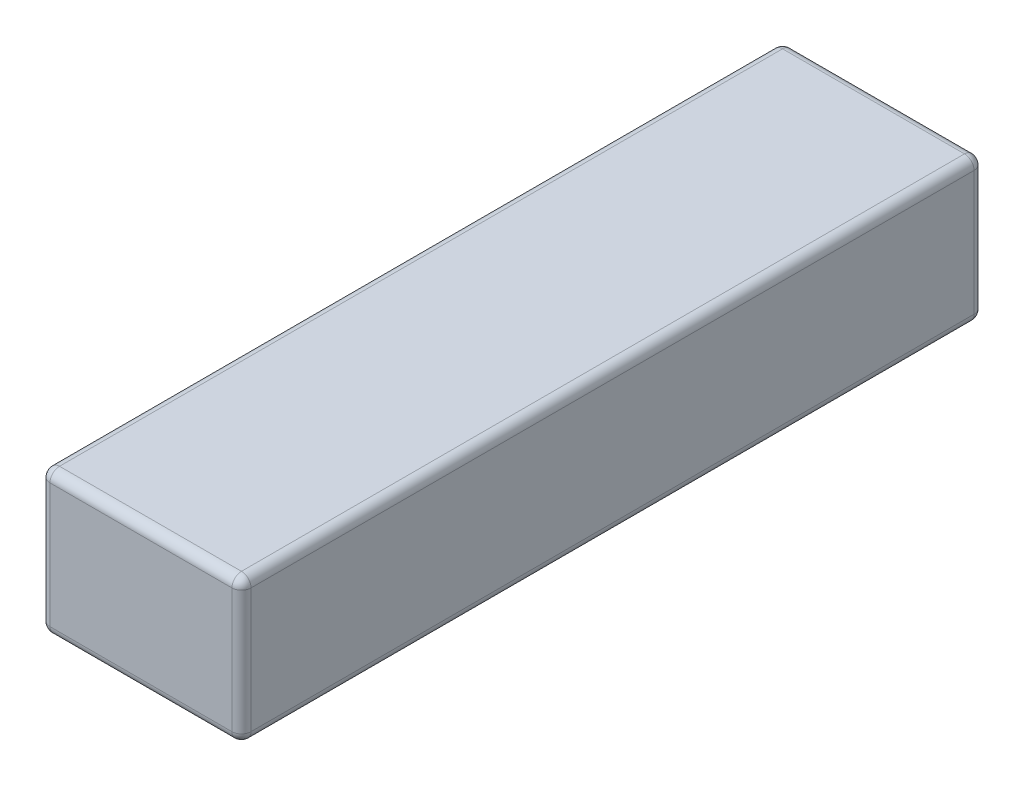
from build123d import *

# Parameters (mm, degrees)
SKETCH_1_W      = 42
SKETCH_1_H      = 30
EXTRUDE_1_DEPTH = 155
FILLET_1_R      = 2


with BuildPart() as part:
    # 스케치1 → 보스-돌출1 (new body)
    with BuildSketch(Plane.XY):
        with Locations((-10.810316775, 2.177184466)):
            Rectangle(SKETCH_1_W, SKETCH_1_H)
    extrude(amount=EXTRUDE_1_DEPTH)

    # 필렛1
    fillet_1_edges = [part.edges().sort_by_distance(p)[0] for p in [
        (-31.810316775, 2.177184466, 155),
        (-10.810316775, -12.822815534, 155),
        (10.189683225, 2.177184466, 155),
        (-10.810316775, -12.822815534, 0),
        (-31.810316775, 2.177184466, 0),
        (-10.810316775, 17.177184466, 0),
        (10.189683225, 2.177184466, 0),
        (-10.810316775, 17.177184466, 155),
        (10.189683225, -12.822815534, 77.5),
        (-31.810316775, -12.822815534, 77.5),
        (-31.810316775, 17.177184466, 77.5),
        (10.189683225, 17.177184466, 77.5),
    ]]
    fillet(fillet_1_edges, radius=FILLET_1_R)


solid = part.part
